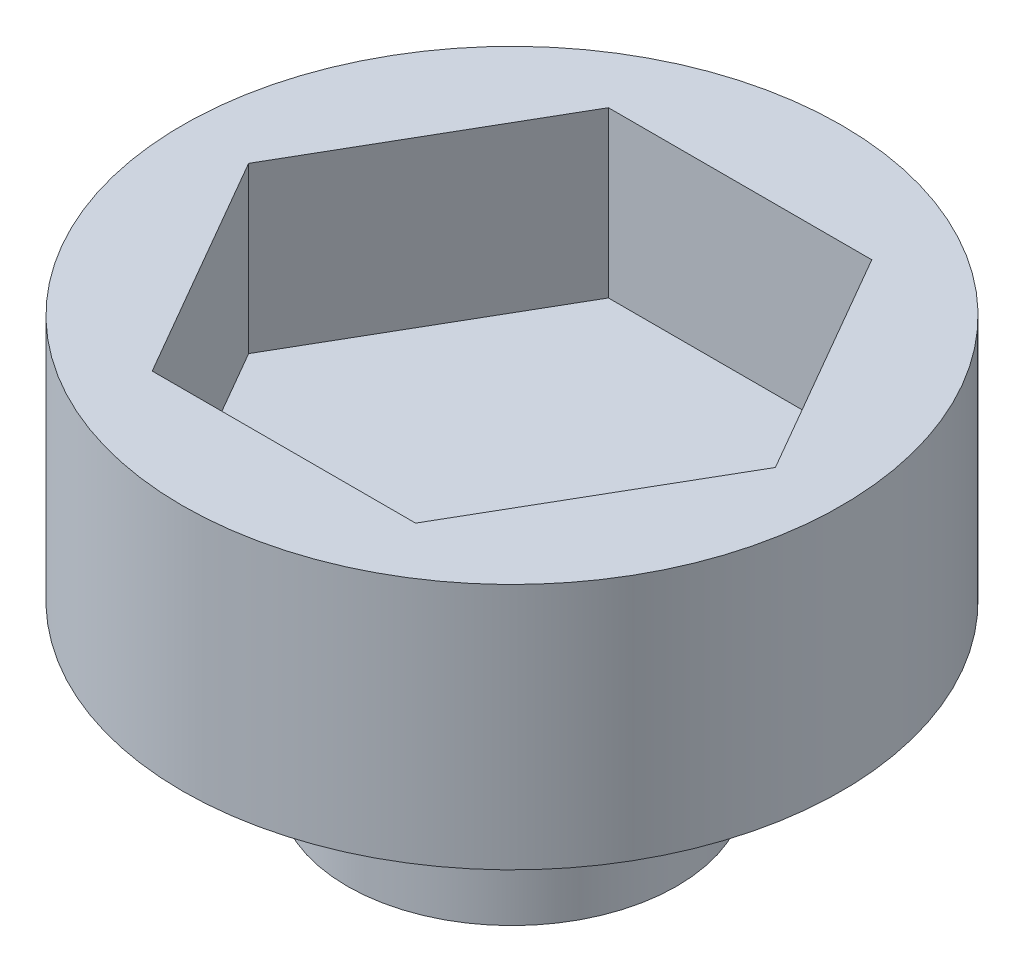
from build123d import *

# Parameters (mm, degrees)
SKETCH1_R           = 2
BOSS_EXTRUDE1_DEPTH = 2
SKETCH2_R           = 4
BOSS_EXTRUDE2_DEPTH = 3
CUT_EXTRUDE1_DEPTH  = 2


with BuildPart() as part:
    # Sketch1 → Boss-Extrude1 (new body)
    with BuildSketch(Plane(origin=(0, 0, 0), x_dir=(1, 0, 0), z_dir=(0, 1, 0))):
        with Locations(Location((0, 0, 0), (0, 0, 270))):
            Circle(SKETCH1_R)
    extrude(amount=BOSS_EXTRUDE1_DEPTH)

    # Sketch2 → Boss-Extrude2 (add)
    with BuildSketch(Plane(origin=(0, 2, 0), x_dir=(1, 0, 0), z_dir=(0, 1, 0))):
        with Locations(Location((0, 0, 0), (0, 0, 270))):
            Circle(SKETCH2_R)
    extrude(amount=BOSS_EXTRUDE2_DEPTH)

    # Sketch3 → Cut-Extrude1 (cut)
    with BuildSketch(Plane(origin=(0, 5, 0), x_dir=(1, 0, 0), z_dir=(0, 1, 0))):
        Polygon((3.19667155, 0), (1.598335775, 2.76839877), (-1.598335775, 2.76839877), (-3.19667155, 0), (-1.598335775, -2.76839877), (1.598335775, -2.76839877), align=None)
    extrude(amount=-CUT_EXTRUDE1_DEPTH, mode=Mode.SUBTRACT)


solid = part.part
